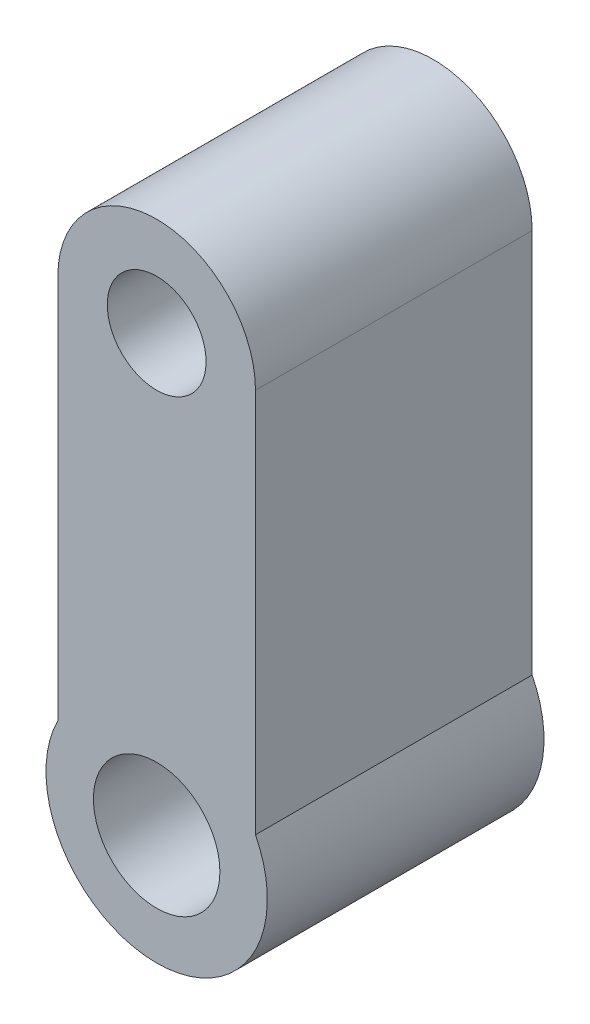
from build123d import *

# Parameters (mm, degrees)
SKETCH1_R           = 25
SKETCH1_R_2         = 12.5
SKETCH1_R_3         = 28
SKETCH1_R_4         = 16
BOSS_EXTRUDE1_DEPTH = 35


with BuildPart() as part:
    # Sketch1 → Boss-Extrude1 (new, symmetric)
    # profile 1 of 3: a face of its own
    with BuildSketch(Plane.XY):
        with BuildLine():
            ThreePointArc((-25, 12.609520213), (0, 28), (25, 12.609520213))
            Line((25, 12.609520213), (25, 110))
            ThreePointArc((25, 110), (0, 85), (-25, 110))
            Line((-25, 110), (-25, 92))
            Line((-25, 92), (-25, 12.609520213))
        make_face()
    # profile 2 of 3: a face of its own
    with BuildSketch(Plane.XY):
        with Locations((0, 110)):
            Circle(SKETCH1_R)
        with Locations((0, 110)):
            Circle(SKETCH1_R_2, mode=Mode.SUBTRACT)
    # profile 3 of 3: a face of its own
    with BuildSketch(Plane.XY):
        Circle(SKETCH1_R_3)
        Circle(SKETCH1_R_4, mode=Mode.SUBTRACT)
    extrude(amount=BOSS_EXTRUDE1_DEPTH, both=True)


solid = part.part
